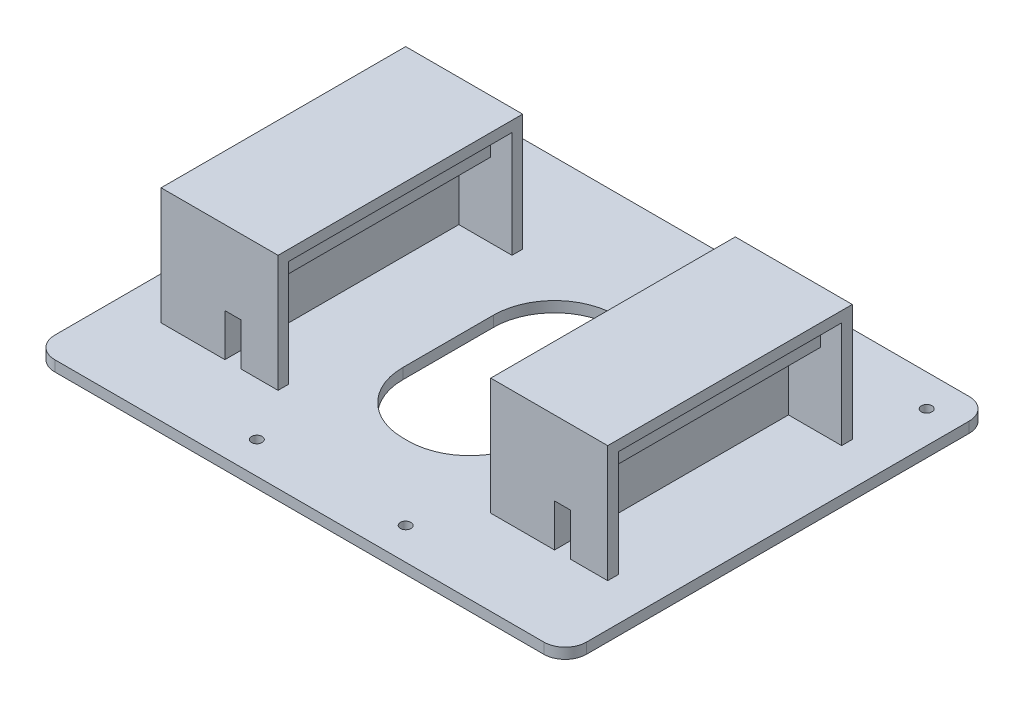
from build123d import *

# Parameters (mm, degrees)
RESSALTO_EXTRUS_O1_DEPTH = 5
ESBO_O2_R                = 2.5
CORTE_EXTRUS_O1_DEPTH    = 5
RESSALTO_EXTRUS_O3_DEPTH = 35
CORTE_EXTRUS_O2_DEPTH    = 10
ESBO_O7_W                = 55
ESBO_O7_H                = 5
RESSALTO_EXTRUS_O4_DEPTH = 20
ESBO_O8_W                = 55
ESBO_O8_H                = 5
ESBO_O8_H_2              = 5.000335185
RESSALTO_EXTRUS_O6_DEPTH = 105
ESBO_O9_W                = 7.5
ESBO_O9_H                = 20
CORTE_EXTRUS_O4_DEPTH    = 5
ESBO_O10_W               = 7.5
ESBO_O10_H               = 20
CORTE_EXTRUS_O5_DEPTH    = 5
ESBO_O11_W               = 105
ESBO_O11_H               = 5.000335185
CORTE_EXTRUS_O6_DEPTH    = 10
ESBO_O12_W               = 105
ESBO_O12_H               = 5.000335185
CORTE_EXTRUS_O7_DEPTH    = 10
ESBO_O13_W               = 105
ESBO_O13_H               = 5.000335185
CORTE_EXTRUS_O8_DEPTH    = 10
ESBO_O14_W               = 105
ESBO_O14_H               = 5.000335185
CORTE_EXTRUS_O9_DEPTH    = 10


with BuildPart() as part:
    # Esboço1 → Ressalto-extrusão1 (new body)
    with BuildSketch(Plane(origin=(0, 0, 0), x_dir=(1, 0, 0), z_dir=(0, 1, 0))):
        with BuildLine():
            Line((140, -100), (-90, -100))
            ThreePointArc((-90, -100), (-97.071067812, -97.071067812), (-100, -90))
            Line((-100, -90), (-100, 90))
            ThreePointArc((-100, 90), (-97.071067812, 97.071067812), (-90, 100))
            Line((-90, 100), (140, 100))
            ThreePointArc((140, 100), (147.071067812, 97.071067812), (150, 90))
            Line((150, 90), (150, -90))
            ThreePointArc((150, -90), (147.071067812, -97.071067812), (140, -100))
        make_face()
    extrude(amount=RESSALTO_EXTRUS_O1_DEPTH)

    # Esboço2 → Corte-extrusão1 (cut)
    with BuildSketch(Plane(origin=(0, 5, 0), x_dir=(1, 0, 0), z_dir=(0, 1, 0))):
        with Locations(Location((-85, 85, 0), (0, 0, 270))):
            Circle(ESBO_O2_R)
        with Locations(Location((-10, -85, 0), (0, 0, 270))):
            Circle(ESBO_O2_R)
        with Locations(Location((60, -85, 0), (0, 0, 270))):
            Circle(ESBO_O2_R)
        with Locations(Location((135, 85, 0), (0, 0, 270))):
            Circle(ESBO_O2_R)
    extrude(amount=-CORTE_EXTRUS_O1_DEPTH, mode=Mode.SUBTRACT)

    # Esboço5 → Ressalto-extrusão3 (add)
    with BuildSketch(Plane(origin=(0, 5, 0), x_dir=(1, 0, 0), z_dir=(0, 1, 0))):
        Polygon((125, -55), (105, -55), (105, 50), (125, 50), (130, 50), (130, 55), (75, 55), (75, 50), (80, 50), (100, 50), (100, -55), (80, -55), (75, -55), (75, -60), (130, -60), (130, -55), align=None)
        Polygon((-50, -55), (-50, 50), (-30, 50), (-25, 50), (-25, 55), (-80, 55), (-80, 50), (-75, 50), (-55, 50), (-55, -55), (-75, -55), (-80, -55), (-80, -60), (-25, -60), (-25, -55), (-30, -55), align=None)
    extrude(amount=RESSALTO_EXTRUS_O3_DEPTH)

    # Esboço6 → Corte-extrusão2 (cut)
    with BuildSketch(Plane(origin=(0, 5, 0), x_dir=(1, 0, 0), z_dir=(0, 1, 0))):
        with BuildLine():
            Line((23.718326371, 50), (26.281673629, 50))
            ThreePointArc((26.281673629, 50), (46.58859695, 41.58859695), (55, 21.281673629))
            Line((55, 21.281673629), (55, -21.281673629))
            ThreePointArc((55, -21.281673629), (46.58859695, -41.58859695), (26.281673629, -50))
            Line((26.281673629, -50), (23.718326371, -50))
            ThreePointArc((23.718326371, -50), (3.41140305, -41.58859695), (-5, -21.281673629))
            Line((-5, -21.281673629), (-5, 21.281673629))
            ThreePointArc((-5, 21.281673629), (3.41140305, 41.58859695), (23.718326371, 50))
        make_face()
    extrude(amount=-CORTE_EXTRUS_O2_DEPTH, mode=Mode.SUBTRACT)

    # Esboço7 → Ressalto-extrusão4 (add)
    with BuildSketch(Plane(origin=(0, 40, 0), x_dir=(1, 0, 0), z_dir=(0, 1, 0))):
        with Locations((102.5, -57.5)):
            Rectangle(ESBO_O7_W, ESBO_O7_H)
        with Locations((102.5, 52.5)):
            Rectangle(ESBO_O7_W, ESBO_O7_H)
        with Locations((-52.5, 52.5)):
            Rectangle(ESBO_O7_W, ESBO_O7_H)
        with Locations((-52.5, -57.5)):
            Rectangle(ESBO_O7_W, ESBO_O7_H)
    extrude(amount=RESSALTO_EXTRUS_O4_DEPTH)

    # Esboço8 → Ressalto-extrusão6 (add)
    with BuildSketch(Plane.XY.offset(-50)):
        with Locations((102.5, 57.5)):
            Rectangle(ESBO_O8_W, ESBO_O8_H)
        with Locations((-52.5, 57.5)):
            Rectangle(ESBO_O8_W, ESBO_O8_H)
        with Locations((102.5, 42.500167593)):
            Rectangle(ESBO_O8_W, ESBO_O8_H_2)
        with Locations((-52.5, 42.500167593)):
            Rectangle(ESBO_O8_W, ESBO_O8_H_2)
    extrude(amount=RESSALTO_EXTRUS_O6_DEPTH)

    # Esboço9 → Corte-extrusão4 (cut)
    with BuildSketch(Plane(origin=(0, 0, -55), x_dir=(-1, 0, 0), z_dir=(0, 0, -1))):
        with Locations((-96.25, 15)):
            Rectangle(ESBO_O9_W, ESBO_O9_H)
        with Locations((58.75, 15)):
            Rectangle(ESBO_O9_W, ESBO_O9_H)
    extrude(amount=-CORTE_EXTRUS_O4_DEPTH, mode=Mode.SUBTRACT)

    # Esboço10 → Corte-extrusão5 (cut)
    with BuildSketch(Plane.XY.offset(60)):
        with Locations((-46.25, 15)):
            Rectangle(ESBO_O10_W, ESBO_O10_H)
        with Locations((108.75, 15)):
            Rectangle(ESBO_O10_W, ESBO_O10_H)
    extrude(amount=-CORTE_EXTRUS_O5_DEPTH, mode=Mode.SUBTRACT)

    # Esboço11 → Corte-extrusão6 (cut)
    with BuildSketch(Plane(origin=(130, 0, 0), x_dir=(0, 0, -1), z_dir=(1, 0, 0))):
        with Locations((-2.5, 42.500167593)):
            Rectangle(ESBO_O11_W, ESBO_O11_H)
    extrude(amount=-CORTE_EXTRUS_O6_DEPTH, mode=Mode.SUBTRACT)

    # Esboço12 → Corte-extrusão7 (cut)
    with BuildSketch(Plane.ZY.offset(-75)):
        with Locations((2.5, 42.500167593)):
            Rectangle(ESBO_O12_W, ESBO_O12_H)
    extrude(amount=-CORTE_EXTRUS_O7_DEPTH, mode=Mode.SUBTRACT)

    # Esboço13 → Corte-extrusão8 (cut)
    with BuildSketch(Plane(origin=(-25, 0, 0), x_dir=(0, 0, -1), z_dir=(1, 0, 0))):
        with Locations((-2.5, 42.500167593)):
            Rectangle(ESBO_O13_W, ESBO_O13_H)
    extrude(amount=-CORTE_EXTRUS_O8_DEPTH, mode=Mode.SUBTRACT)

    # Esboço14 → Corte-extrusão9 (cut)
    with BuildSketch(Plane.ZY.offset(80)):
        with Locations((2.5, 42.500167593)):
            Rectangle(ESBO_O14_W, ESBO_O14_H)
    extrude(amount=-CORTE_EXTRUS_O9_DEPTH, mode=Mode.SUBTRACT)


solid = part.part
